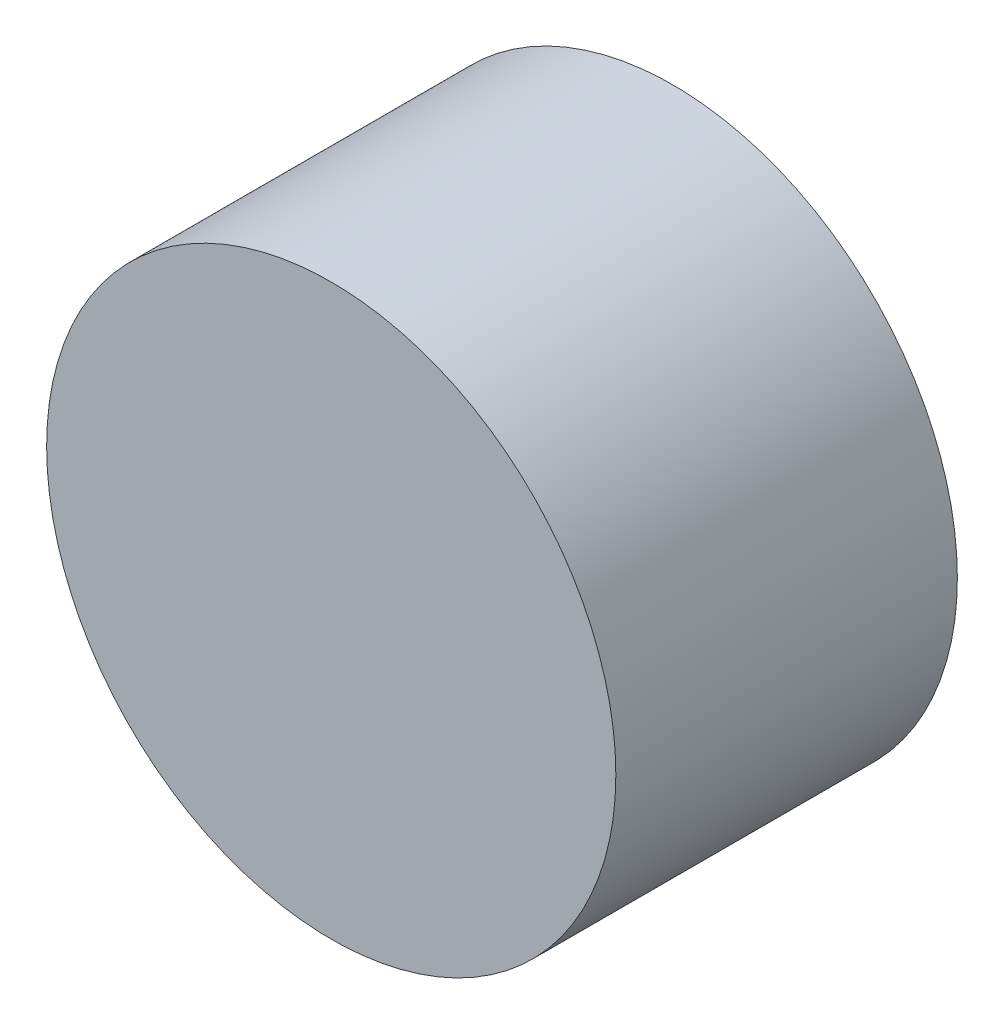
from build123d import *

# Parameters (mm, degrees)
SKETCH1_R           = 2.5
BOSS_EXTRUDE1_DEPTH = 1.5


with BuildPart() as part:
    # Sketch1 → Boss-Extrude1 (new, symmetric)
    with BuildSketch(Plane.XY):
        Circle(SKETCH1_R)
    extrude(amount=BOSS_EXTRUDE1_DEPTH, both=True)


solid = part.part
